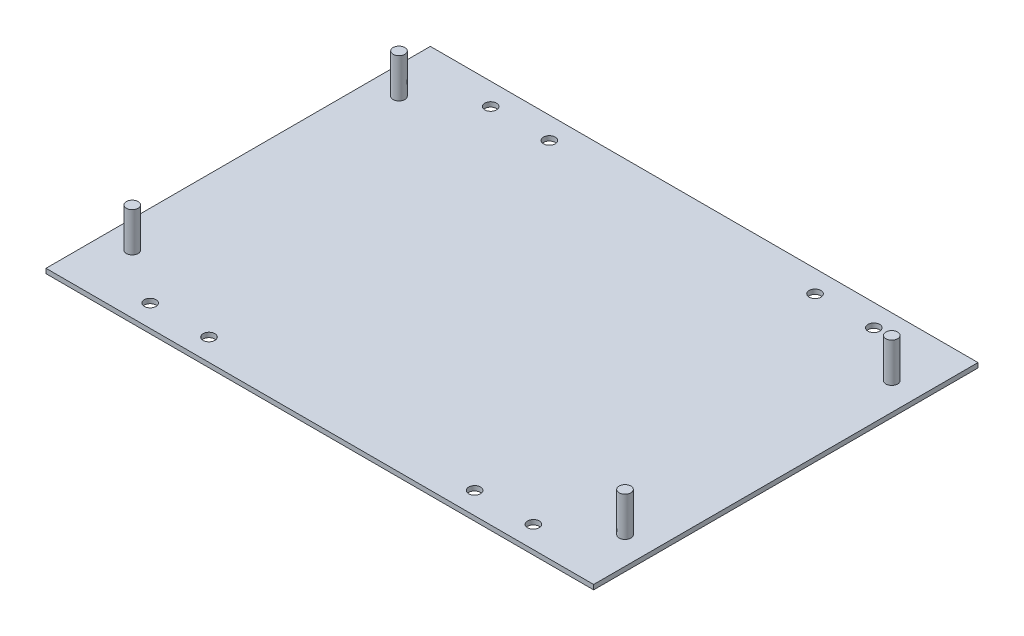
from build123d import *

# Parameters (mm, degrees)
SKETCH1_W           = 139.7
SKETCH1_H           = 98.044
SKETCH1_R           = 1.5
BOSS_EXTRUDE1_DEPTH = 1.2
SKETCH2_R           = 1.5
BOSS_EXTRUDE2_DEPTH = 10


with BuildPart() as part:
    # Sketch1 → Boss-Extrude1 (new body)
    with BuildSketch(Plane(origin=(0, 0, 0), x_dir=(1, 0, 0), z_dir=(0, 1, 0))):
        with Locations((0, 3.302)):
            Rectangle(SKETCH1_W, SKETCH1_H)
        with Locations(Location((-48.8772454, -40.12, 0), (0, 0, 270))):
            Circle(SKETCH1_R, mode=Mode.SUBTRACT)
        with Locations(Location((-33.8772454, -40.12, 0), (0, 0, 270))):
            Circle(SKETCH1_R, mode=Mode.SUBTRACT)
        with Locations(Location((-33.891248194, 46.724, 0), (0, 0, 90))):
            Circle(SKETCH1_R, mode=Mode.SUBTRACT)
        with Locations(Location((-48.877248194, 46.724, 0), (0, 0, 90))):
            Circle(SKETCH1_R, mode=Mode.SUBTRACT)
        with Locations(Location((33.878607802, 46.724, 0), (0, 0, 270))):
            Circle(SKETCH1_R, mode=Mode.SUBTRACT)
        with Locations(Location((48.8772454, 46.724, 0), (0, 0, 270))):
            Circle(SKETCH1_R, mode=Mode.SUBTRACT)
        with Locations(Location((33.8772454, -40.12, 0), (0, 0, 90))):
            Circle(SKETCH1_R, mode=Mode.SUBTRACT)
        with Locations(Location((48.8772454, -40.12, 0), (0, 0, 90))):
            Circle(SKETCH1_R, mode=Mode.SUBTRACT)
    extrude(amount=BOSS_EXTRUDE1_DEPTH)

    # Sketch2 → Boss-Extrude2 (add)
    with BuildSketch(Plane(origin=(0, 1.2, 0), x_dir=(1, 0, 0), z_dir=(0, 1, 0))):
        with Locations(Location((-62.85, 37.324, 0), (0, 0, 90))):
            Circle(SKETCH2_R)
        with Locations(Location((-62.85, -30.72, 0), (0, 0, 90))):
            Circle(SKETCH2_R)
        with Locations(Location((62.85, -30.72, 0), (0, 0, 90))):
            Circle(SKETCH2_R)
        with Locations(Location((62.85, 37.324, 0), (0, 0, 90))):
            Circle(SKETCH2_R)
    extrude(amount=BOSS_EXTRUDE2_DEPTH)


solid = part.part
